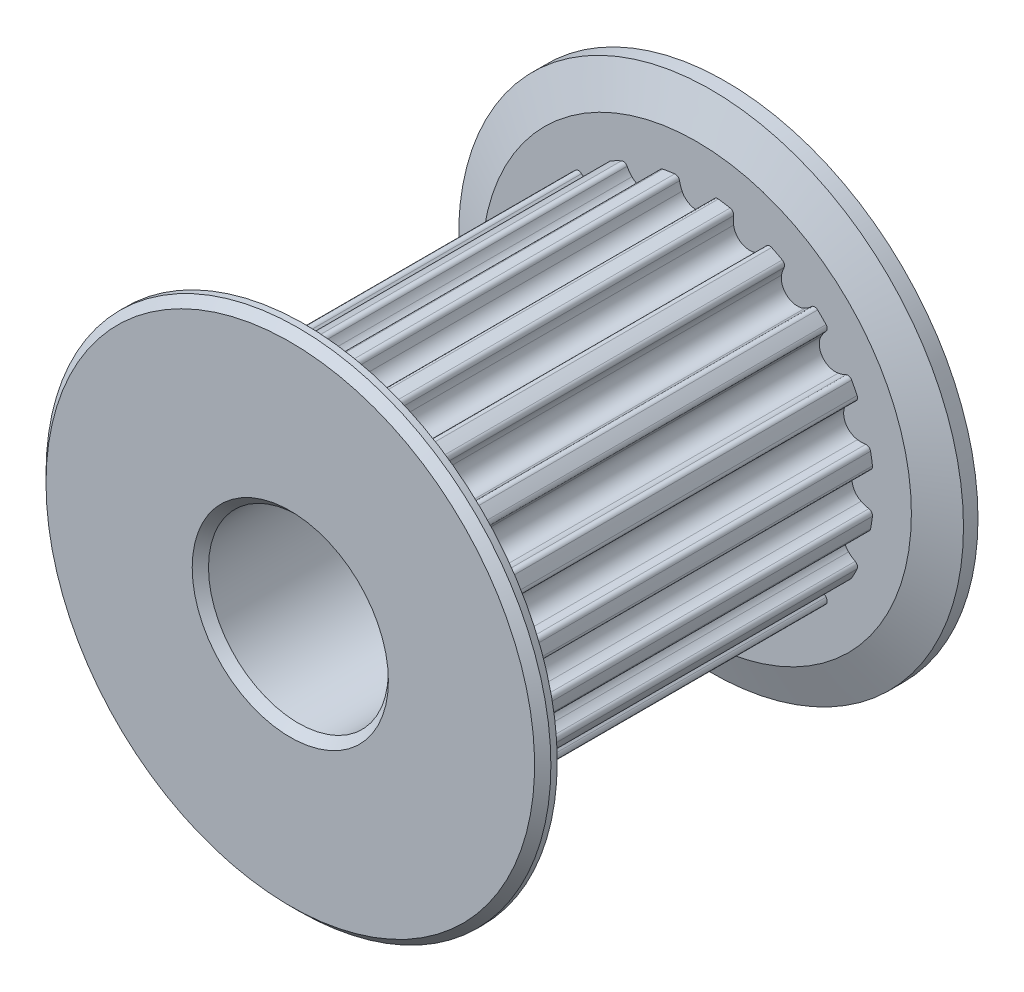
from build123d import *

# Parameters (mm, degrees)
CUT_EXTRUDE1_START  = 6.5
CUT_EXTRUDE1_DEPTH  = 13
CIRPATTERN1_COUNT   = 20
CHAMFER1_SIZE       = 0.28075
SKETCH5_W           = 3.376388604
SKETCH5_H           = 0.5
BOSS_EXTRUDE1_DEPTH = 9


with BuildPart() as part:
    # Sketch2 → Revolve1 (revolve)
    with BuildSketch(Plane(origin=(0, 0, 0), x_dir=(0, 0, -1), z_dir=(1, 0, 0)), mode=Mode.PRIVATE) as revolve1_sk:
        Polygon((-7.5, 3.1), (7.5, 3.1), (7.5, 8.6995), (7, 8.6995), (6.5, 7.404), (6.5, 6.1085), (-6.5, 6.1085), (-6.5, 7.404), (-7, 8.6995), (-7.5, 8.6995), align=None)
    revolve(revolve1_sk.sketch.rotate(Axis((0, 0, 7.5), (0, 0, -1)), 90), axis=Axis((0, 0, 7.5), (0, 0, -1)))

    # Sketch3 → Cut-Extrude1 (cut)
    with BuildSketch(Plane.XY.offset(CUT_EXTRUDE1_START)):
        with BuildLine():
            Line((2.840989707, 8.6995), (-2.840989707, 8.6995))
            Line((-2.840989707, 8.6995), (-1.896292335, 5.806707124))
            ThreePointArc((-1.896292335, 5.806707124), (-1.330166224, 5.961914966), (-0.751756185, 6.062065233))
            ThreePointArc((-0.751756185, 6.062065233), (-0.643911332, 6.033664451), (-0.58547487, 5.93867868))
            ThreePointArc((-0.58547487, 5.93867868), (-0.551683777, 5.801420225), (-0.498876404, 5.670297753))
            ThreePointArc((-0.498876404, 5.670297753), (0, 5.3585), (0.498876404, 5.670297753))
            ThreePointArc((0.498876404, 5.670297753), (0.551683777, 5.801420225), (0.58547487, 5.93867868))
            ThreePointArc((0.58547487, 5.93867868), (0.643911332, 6.033664451), (0.751756185, 6.062065233))
            ThreePointArc((0.751756185, 6.062065233), (1.330166224, 5.961914966), (1.896292335, 5.806707124))
            Line((1.896292335, 5.806707124), (2.840989707, 8.6995))
        make_face()
    cut_extrude1 = extrude(amount=-CUT_EXTRUDE1_DEPTH, mode=Mode.SUBTRACT)

    # CirPattern1: Cut-Extrude1 ×20 about axis
    cirpattern1_axis = Axis((0, 0, 0), (0, 0, 1))
    for i in range(1, CIRPATTERN1_COUNT):
        add(cut_extrude1.rotate(cirpattern1_axis, i * 360 / CIRPATTERN1_COUNT), mode=Mode.SUBTRACT)

    # Chamfer1
    chamfer1_edges = [part.edges().sort_by_distance(p)[0] for p in [
        (-3.1, 0, 7.5),
        (-8.6995, 0, 7.5),
    ]]
    chamfer(chamfer1_edges, length=CHAMFER1_SIZE)

    # Sketch5 → Boss-Extrude1 (add)
    with BuildSketch(Plane(origin=(0, 0, -7.5), x_dir=(-1, 0, 0), z_dir=(0, 0, -1))):
        with Locations((0, -2.85)):
            Rectangle(SKETCH5_W, SKETCH5_H)
    extrude(amount=-BOSS_EXTRUDE1_DEPTH)


solid = part.part
